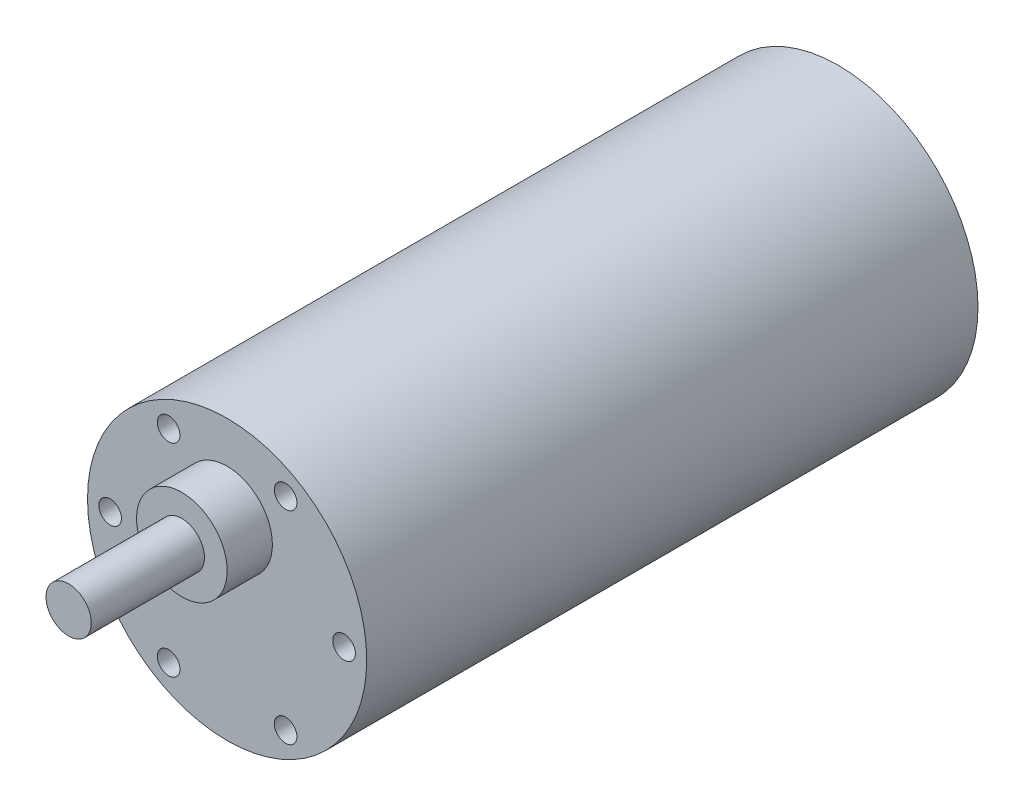
from build123d import *

# Parameters (mm, degrees)
BOSS_EXTRUDE1_DEPTH      = 24
BOSS_EXTRUDE1_DEPTH_BACK = 57
SKETCH1_R                = 18.5
SKETCH2_R                = 1.5
CUT_EXTRUDE1_DEPTH       = 5
SKETCH3_R                = 6
SKETCH3_R_2              = 3
BOSS_EXTRUDE2_DEPTH      = 6
SKETCH3_2_R              = 3
BOSS_EXTRUDE3_DEPTH      = 21


with BuildPart() as part:
    # Sketch1 → Boss-Extrude1 (new, two sides: drawn at the far end of the back side and taken through both)
    with BuildSketch(Plane.XY.offset(-BOSS_EXTRUDE1_DEPTH_BACK)):
        Circle(SKETCH1_R)
    extrude(amount=BOSS_EXTRUDE1_DEPTH + BOSS_EXTRUDE1_DEPTH_BACK)

    # Sketch2 → Cut-Extrude1 (cut)
    with BuildSketch(Plane.XY.offset(24)):
        with Locations((15.5, 0)):
            Circle(SKETCH2_R)
        with Locations((7.75, -13.423393759)):
            Circle(SKETCH2_R)
        with Locations((-7.75, -13.423393759)):
            Circle(SKETCH2_R)
        with Locations((-15.5, 0)):
            Circle(SKETCH2_R)
        with Locations((-7.75, 13.423393759)):
            Circle(SKETCH2_R)
        with Locations((7.75, 13.423393759)):
            Circle(SKETCH2_R)
    extrude(amount=-CUT_EXTRUDE1_DEPTH, mode=Mode.SUBTRACT)

    # Sketch3 → Boss-Extrude2 (add)
    with BuildSketch(Plane.XY.offset(24)):
        with Locations((0, 7)):
            Circle(SKETCH3_R)
        with Locations((0, 7)):
            Circle(SKETCH3_R_2, mode=Mode.SUBTRACT)
    extrude(amount=BOSS_EXTRUDE2_DEPTH)

    # Sketch3<2> → Boss-Extrude3 (add)
    with BuildSketch(Plane.XY.offset(24)):
        with Locations((0, 7)):
            Circle(SKETCH3_2_R)
    extrude(amount=BOSS_EXTRUDE3_DEPTH)


solid = part.part
